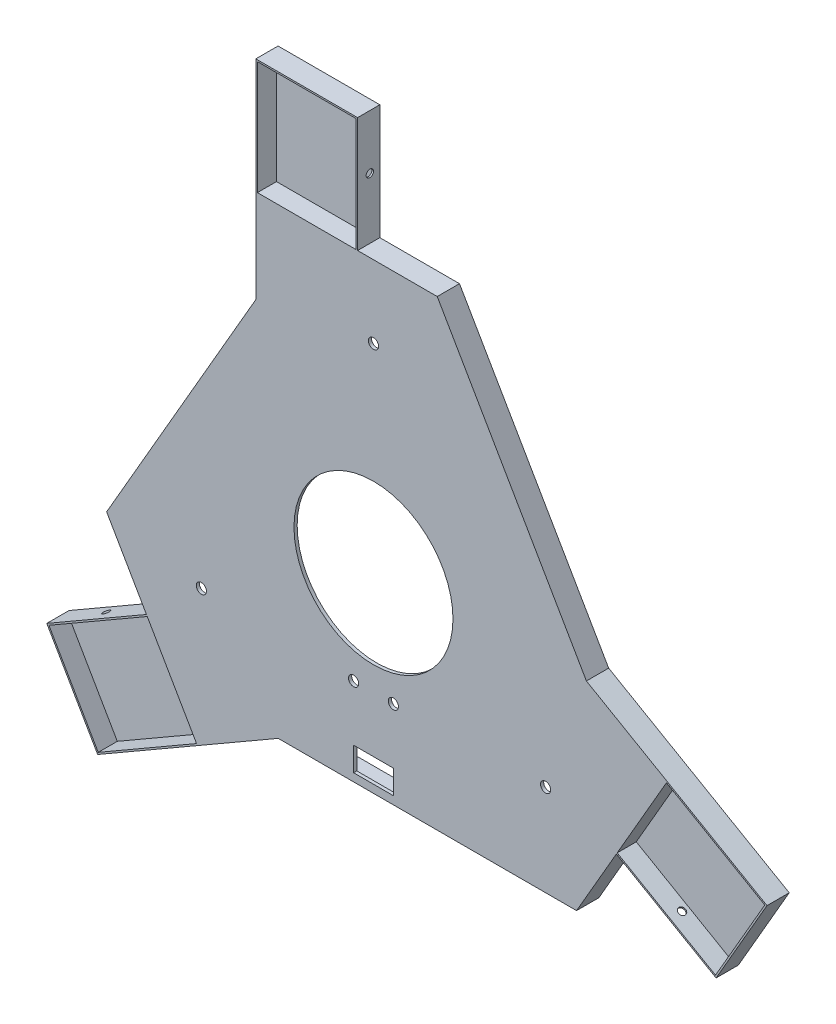
from build123d import *
from build123d.topology import SkipClean

# Parameters (mm, degrees)
SKETCH_1_R           = 255
EXTRUDE_1_DEPTH      = 1
CUT_EXTRUDE_1_DEPTH  = 361.625844886
EXTRUDE_START        = 13
EXTRUDE_3_DEPTH      = 13
CUT_EXTRUDE_6_DEPTH  = 12
SKETCH_9_R           = 50
CUT_EXTRUDE_7_DEPTH  = 14
CUT_EXTRUDE_START    = -24
CUT_EXTRUDE_8_DEPTH  = 24
CUT_EXTRUDE_9_DEPTH  = 12
SKETCH_12_R          = 3.2
CUT_EXTRUDE_10_DEPTH = 10
SKETCH_13_R          = 3.2
CUT_EXTRUDE_11_DEPTH = 10
SKETCH_14_R          = 2.25
CUT_EXTRUDE_12_DEPTH = 10
SKETCH_16_R          = 2.3
CUT_EXTRUDE_13_DEPTH = 10
SKETCH_15_R          = 2.25
CUT_EXTRUDE_14_DEPTH = 10
SKETCH_17_W          = 25
SKETCH_17_H          = 15
CUT_EXTRUDE_15_DEPTH = 4.5


with BuildPart() as part:
    # 草图1 → 拉伸1 (new body)
    with BuildSketch(Plane.XY):
        Circle(SKETCH_1_R)
    extrude(amount=EXTRUDE_1_DEPTH)

    # 草图2 → 切除-拉伸1 (cut, through all)
    with BuildSketch(Plane.XY.offset(1)):
        with BuildLine():
            Line((-74, 244.02663789), (-74, 111.900834456))
            Line((-74, 111.900834456), (-148.774990748, -17.613248654))
            Line((-148.774990748, -17.613248654), (-167.81626488, -50.593702892))
            Line((-167.81626488, -50.593702892), (-142.769914648, -93.975254038))
            Line((-142.769914648, -93.975254038), (-215.666603726, -136.0621771))
            ThreePointArc((-215.666603726, -136.0621771), (-238.942591743, 89.058620308), (-74, 244.02663789))
        make_face()
        with BuildLine():
            Line((133.908965344, 8.135462652), (248.333267613, -57.927439065))
            ThreePointArc((248.333267613, -57.927439065), (196.598323484, 162.401044341), (-10, 254.803846125))
            Line((-10, 254.803846125), (-10, 170.63))
            Line((-10, 170.63), (40.092700464, 170.63))
            Line((40.092700464, 170.63), (59.133974596, 137.649545762))
            Line((59.133974596, 137.649545762), (133.908965344, 8.135462652))
        make_face()
        with BuildLine():
            Line((-174.333267613, -186.099198825), (-59.908965344, -120.036297108))
            Line((-59.908965344, -120.036297108), (89.641016151, -120.036297108))
            Line((89.641016151, -120.036297108), (127.723564416, -120.036297108))
            Line((127.723564416, -120.036297108), (152.769914648, -76.654745962))
            Line((152.769914648, -76.654745962), (225.666603726, -118.741669025))
            ThreePointArc((225.666603726, -118.741669025), (42.344268258, -251.45966465), (-174.333267613, -186.099198825))
        make_face()
    extrude(amount=-CUT_EXTRUDE_1_DEPTH, mode=Mode.SUBTRACT)

    # 草图7 → 拉伸3 (add)
    with BuildSketch(Plane(origin=(0, 0, 0), x_dir=(-1, 0, 0), z_dir=(0, 0, -1)).offset(EXTRUDE_START)):
        with BuildLine():
            Line((-133.908965344, 8.135462652), (-248.333267613, -57.927439065))
            ThreePointArc((-248.333267613, -57.927439065), (-238.942591743, -89.058620308), (-225.666603726, -118.741669025))
            Line((-225.666603726, -118.741669025), (-152.769914648, -76.654745962))
            Line((-152.769914648, -76.654745962), (-127.723564416, -120.036297108))
            Line((-127.723564416, -120.036297108), (59.908965344, -120.036297108))
            Line((59.908965344, -120.036297108), (174.333267613, -186.099198825))
            ThreePointArc((174.333267613, -186.099198825), (196.598323484, -162.401044341), (215.666603726, -136.0621771))
            Line((215.666603726, -136.0621771), (142.769914648, -93.975254038))
            Line((142.769914648, -93.975254038), (167.81626488, -50.593702892))
            Line((167.81626488, -50.593702892), (74, 111.900834456))
            Line((74, 111.900834456), (74, 244.02663789))
            ThreePointArc((74, 244.02663789), (42.344268258, 251.45966465), (10, 254.803846125))
            Line((10, 254.803846125), (10, 170.63))
            Line((10, 170.63), (-40.092700464, 170.63))
            Line((-40.092700464, 170.63), (-133.908965344, 8.135462652))
        make_face()
    extrude(amount=-EXTRUDE_3_DEPTH)

    # 草图8 → 切除-拉伸6 (cut)
    with SkipClean():  # the faces are left unmerged after this step: merging them gives an invalid solid
        with BuildSketch(Plane(origin=(0, 0, -13), x_dir=(-1, 0, 0), z_dir=(0, 0, -1))):
            Polygon((-39.515350195, 169.63), (-133.176914536, 7.403411844), (-183.403889244, -21.595145524), (-151.903889244, -76.154745962), (-127.146214147, -119.036297108), (60.176914536, -119.036297108), (110.403889244, -148.034854476), (141.903889244, -93.475254038), (166.661564341, -50.593702892), (73, 111.632885264), (73, 169.63), (10, 169.63), align=None)
        extrude(amount=-CUT_EXTRUDE_6_DEPTH, mode=Mode.SUBTRACT)

    # 草图9 → 切除-拉伸7 (cut)
    with SkipClean():  # the faces are left unmerged after this step: merging them gives an invalid solid
        with BuildSketch(Plane(origin=(0, 0, -1), x_dir=(-1, 0, 0), z_dir=(0, 0, -1))):
            Circle(SKETCH_9_R)
        extrude(amount=-CUT_EXTRUDE_7_DEPTH, mode=Mode.SUBTRACT)

    # 草图10 → 切除-拉伸8 (cut)
    with BuildSketch(Plane.XY.offset(1).offset(CUT_EXTRUDE_START)):
        with BuildLine():
            Line((225.666603726, -118.741669025), (215.467242209, -112.853064907))
            Line((215.467242209, -112.853064907), (247.467242209, -57.427439065))
            Line((247.467242209, -57.427439065), (248.333267613, -57.927439065))
            ThreePointArc((248.333267613, -57.927439065), (238.942591743, -89.058620308), (225.666603726, -118.741669025))
        make_face()
        with BuildLine():
            Line((-74, 243.02663789), (-10, 243.02663789))
            Line((-10, 243.02663789), (-10, 254.803846125))
            ThreePointArc((-10, 254.803846125), (-42.344268258, 251.45966465), (-74, 244.02663789))
            Line((-74, 244.02663789), (-74, 243.02663789))
        make_face()
        with BuildLine():
            Line((-215.666603726, -136.0621771), (-205.467242209, -130.173572983))
            Line((-205.467242209, -130.173572983), (-173.467242209, -185.599198825))
            Line((-173.467242209, -185.599198825), (-174.333267613, -186.099198825))
            ThreePointArc((-174.333267613, -186.099198825), (-196.598323484, -162.401044341), (-215.666603726, -136.0621771))
        make_face()
    extrude(amount=CUT_EXTRUDE_8_DEPTH, mode=Mode.SUBTRACT)

    # 草图11 → 切除-拉伸9 (cut)
    with BuildSketch(Plane.XY.offset(1)):
        Polygon((-11, 170.669617313), (-73, 170.669617313), (-73, 171.63), (-73, 242.02663789), (-11, 242.02663789), (-11, 171.63), align=None)
        Polygon((153.269914648, -75.788720558), (184.269914648, -22.095145524), (246.101216805, -57.793464469), (215.101216805, -111.487039503), align=None)
        Polygon((-173.101216805, -184.233173421), (-204.101216805, -130.539598387), (-142.269914648, -94.841279442), (-111.269914648, -148.534854476), align=None)
    extrude(amount=-CUT_EXTRUDE_9_DEPTH, mode=Mode.SUBTRACT)

    # 草图12 → 切除-拉伸10 (cut)
    with BuildSketch(Plane(origin=(0, 0, -1), x_dir=(-1, 0, 0), z_dir=(0, 0, -1))):
        with Locations((-12.5, -65)):
            Circle(SKETCH_12_R)
        with Locations((12.5, -65)):
            Circle(SKETCH_12_R)
    extrude(amount=-CUT_EXTRUDE_10_DEPTH, mode=Mode.SUBTRACT)

    # 草图13 → 切除-拉伸11 (cut)
    with BuildSketch(Plane(origin=(0, 0, -1), x_dir=(-1, 0, 0), z_dir=(0, 0, -1))):
        with Locations((0, 125)):
            Circle(SKETCH_13_R)
        with Locations((108.253175473, -62.5)):
            Circle(SKETCH_13_R)
        with Locations((-108.253175473, -62.5)):
            Circle(SKETCH_13_R)
    extrude(amount=-CUT_EXTRUDE_11_DEPTH, mode=Mode.SUBTRACT)

    # 草图14 → 切除-拉伸12 (cut)
    with BuildSketch(Plane(origin=(5, -8.660254038, 0), x_dir=(-0.8660254037844386, -0.5000000000000001, 0), z_dir=(-0.5000000000000001, 0.8660254037844386, 0))):
        with Locations((208.832756681, -6.69566134)):
            Circle(SKETCH_14_R)
    extrude(amount=-CUT_EXTRUDE_12_DEPTH, mode=Mode.SUBTRACT)

    # 草图16 → 切除-拉伸13 (cut)
    with BuildSketch(Plane(origin=(-10, 0, 0), x_dir=(0, 0, -1), z_dir=(1, 0, 0))):
        with Locations(Location((6.69566134, 208.832756681, 0), (0, 0, 90))):
            Circle(SKETCH_16_R)
    extrude(amount=-CUT_EXTRUDE_13_DEPTH, mode=Mode.SUBTRACT)

    # 草图15 → 切除-拉伸14 (cut)
    with BuildSketch(Plane(origin=(5, 8.660254038, 0), x_dir=(0.8660254037844386, -0.5, 0), z_dir=(-0.5000000000000001, -0.8660254037844387, 0))):
        with Locations((208.832756681, -6.69566134)):
            Circle(SKETCH_15_R)
    extrude(amount=-CUT_EXTRUDE_14_DEPTH, mode=Mode.SUBTRACT)

    # 草图17 → 切除-拉伸15 (cut)
    with BuildSketch(Plane(origin=(0, 0, -1), x_dir=(-1, 0, 0), z_dir=(0, 0, -1))):
        with Locations((0, -107.536297108)):
            Rectangle(SKETCH_17_W, SKETCH_17_H)
    extrude(amount=-CUT_EXTRUDE_15_DEPTH, mode=Mode.SUBTRACT)


solid = part.part
